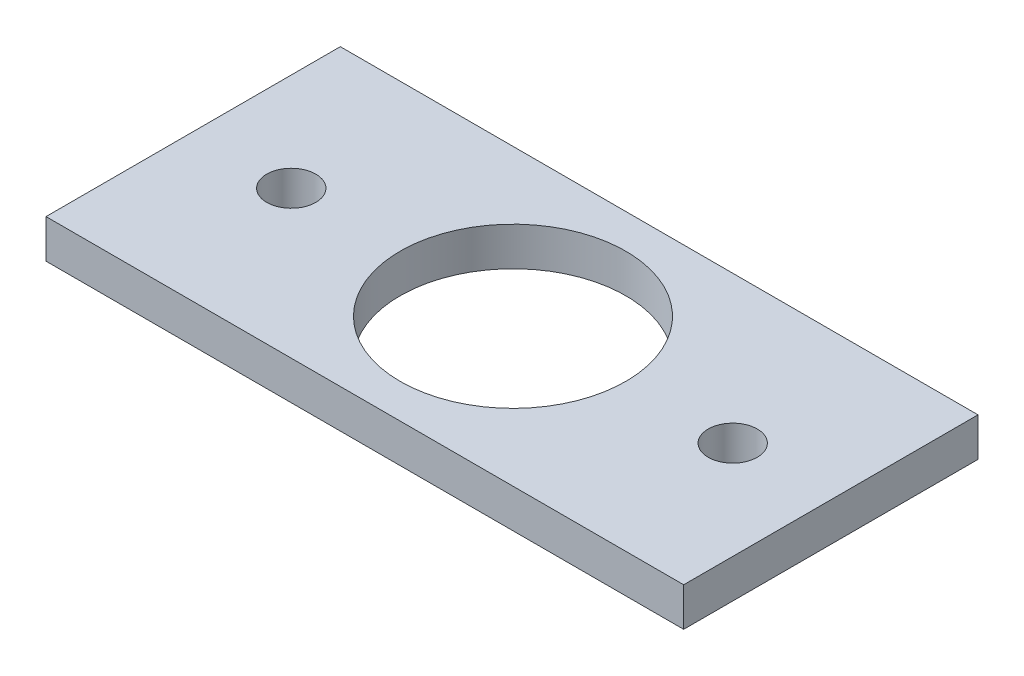
from build123d import *

# Parameters (mm, degrees)
SKETCH1_W           = 82.55
SKETCH1_H           = 38.1
SKETCH1_R           = 14.605
SKETCH1_R_2         = 3.175
BOSS_EXTRUDE1_DEPTH = 5


with BuildPart() as part:
    # Sketch1 → Boss-Extrude1 (new body)
    with BuildSketch(Plane(origin=(0, 0, 0), x_dir=(1, 0, 0), z_dir=(0, 1, 0))):
        with Locations((-0.127, 0)):
            Rectangle(SKETCH1_W, SKETCH1_H)
        with Locations(Location((0, 0, 0), (0, 0, 270))):
            Circle(SKETCH1_R, mode=Mode.SUBTRACT)
        with Locations(Location((28.448, 0, 0), (0, 0, 270))):
            Circle(SKETCH1_R_2, mode=Mode.SUBTRACT)
        with Locations(Location((-28.702, 0, 0), (0, 0, 270))):
            Circle(SKETCH1_R_2, mode=Mode.SUBTRACT)
    extrude(amount=BOSS_EXTRUDE1_DEPTH)


solid = part.part
